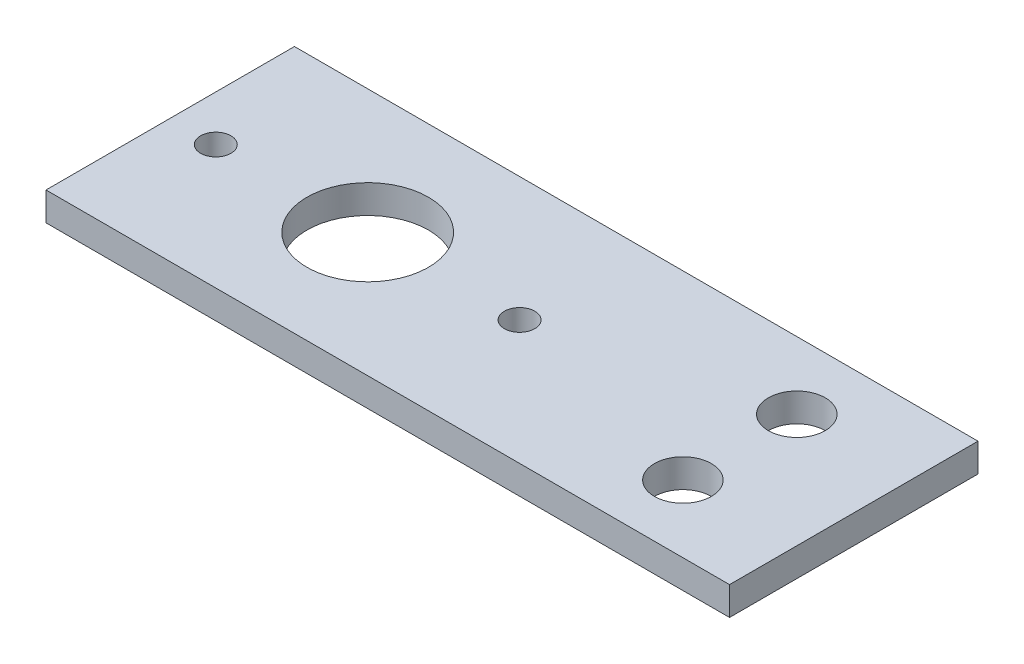
from build123d import *

# Parameters (mm, degrees)
SKETCH3_W           = 114.3
SKETCH3_H           = 41.547963652
SKETCH3_R           = 2.54
SKETCH3_R_2         = 10.16
SKETCH3_R_3         = 4.7625
BOSS_EXTRUDE1_DEPTH = 4.7625


with BuildPart() as part:
    # Sketch3 → Boss-Extrude1 (new body)
    with BuildSketch(Plane(origin=(0, 0, 0), x_dir=(1, 0, 0), z_dir=(0, 1, 0))):
        with Locations((-57.15, 0)):
            Rectangle(SKETCH3_W, SKETCH3_H)
        with Locations(Location((-106.68, 0, 0), (0, 0, 90))):
            Circle(SKETCH3_R, mode=Mode.SUBTRACT)
        with Locations(Location((-81.28, 0, 0), (0, 0, 90))):
            Circle(SKETCH3_R_2, mode=Mode.SUBTRACT)
        with Locations(Location((-55.88, 0, 0), (0, 0, 90))):
            Circle(SKETCH3_R, mode=Mode.SUBTRACT)
        with Locations(Location((-19.05, 9.525, 0), (0, 0, 90))):
            Circle(SKETCH3_R_3, mode=Mode.SUBTRACT)
        with Locations(Location((-19.05, -9.525, 0), (0, 0, 90))):
            Circle(SKETCH3_R_3, mode=Mode.SUBTRACT)
    extrude(amount=BOSS_EXTRUDE1_DEPTH)


solid = part.part
